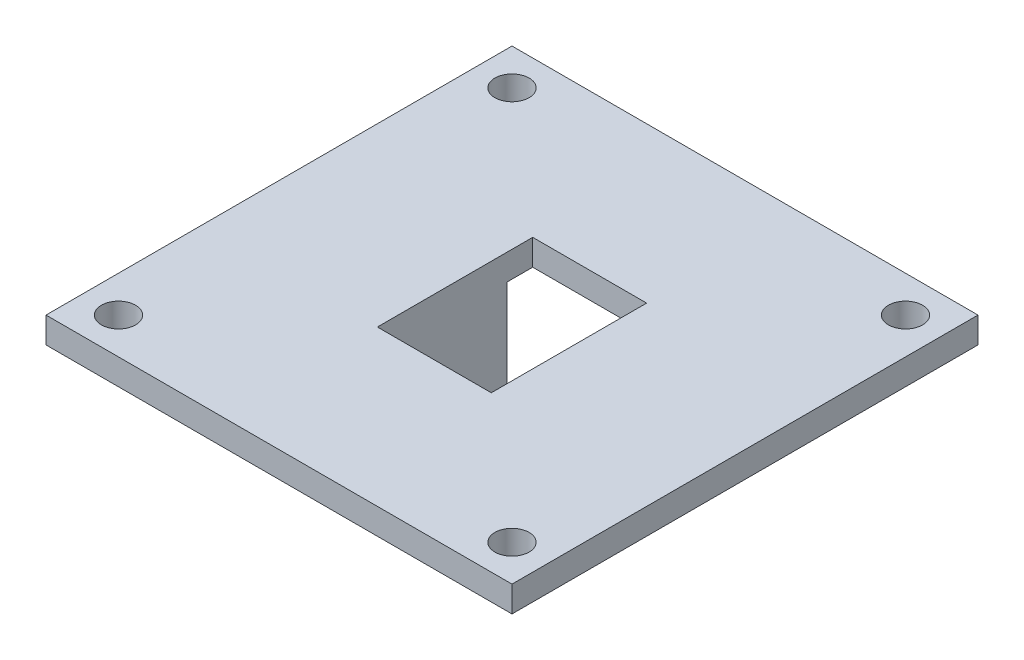
from build123d import *

# Parameters (mm, degrees)
SKETCH_1_R               = 19
EXTRUDE_1_DEPTH          = 3
CUT_EXTRUDE_1_REACH      = 29.037
SKETCH_2_R               = 1.6
SKETCH_3_W               = 4
SKETCH_3_H               = 20
EXTRUDE_2_DEPTH          = 20
SKETCH_4_W               = 90
SKETCH_4_H               = 90
EXTRUDE_3_DEPTH          = 5
CUT_EXTRUDE_2_DEPTH      = 70.526973183
CUT_EXTRUDE_2_DEPTH_BACK = 70.526973183
SKETCH_5_R               = 3.3
CUT_EXTRUDE_3_DEPTH      = 70.526973183
CUT_EXTRUDE_3_DEPTH_BACK = 5
SKETCH_6_W               = 22
SKETCH_6_H               = 30


with BuildPart() as part:
    # 草图1 → 凸台-拉伸1 (new body)
    with BuildSketch(Plane(origin=(0, 0, 0), x_dir=(1, 0, 0), z_dir=(0, 1, 0))):
        with Locations(Location((0, 0, 0), (0, 0, 270))):
            Circle(SKETCH_1_R)
    extrude(amount=EXTRUDE_1_DEPTH)

    # 草图2 → 切除-拉伸1 (cut, up to next)
    with BuildSketch(Plane(origin=(0, 3, 0), x_dir=(1, 0, 0), z_dir=(0, 1, 0)), mode=Mode.PRIVATE) as cut_extrude_1_sk1:
        with Locations(Location((-5, 0, 0), (0, 0, 270))):
            Circle(SKETCH_2_R)
    cut_extrude_1_tool1 = extrude(cut_extrude_1_sk1.sketch, amount=-CUT_EXTRUDE_1_REACH, mode=Mode.PRIVATE) & part.part
    # 草图2 → 切除-拉伸1 (cut, up to next)
    with BuildSketch(Plane(origin=(0, 3, 0), x_dir=(1, 0, 0), z_dir=(0, 1, 0)), mode=Mode.PRIVATE) as cut_extrude_1_sk2:
        with Locations(Location((0, 0, 0), (0, 0, 270))):
            Circle(SKETCH_2_R)
    cut_extrude_1_tool2 = extrude(cut_extrude_1_sk2.sketch, amount=-CUT_EXTRUDE_1_REACH, mode=Mode.PRIVATE) & part.part
    # 草图2 → 切除-拉伸1 (cut, up to next)
    with BuildSketch(Plane(origin=(0, 3, 0), x_dir=(1, 0, 0), z_dir=(0, 1, 0)), mode=Mode.PRIVATE) as cut_extrude_1_sk3:
        with Locations(Location((5, 0, 0), (0, 0, 270))):
            Circle(SKETCH_2_R)
    cut_extrude_1_tool3 = extrude(cut_extrude_1_sk3.sketch, amount=-CUT_EXTRUDE_1_REACH, mode=Mode.PRIVATE) & part.part
    # 草图2 → 切除-拉伸1 (cut, up to next)
    with BuildSketch(Plane(origin=(0, 3, 0), x_dir=(1, 0, 0), z_dir=(0, 1, 0)), mode=Mode.PRIVATE) as cut_extrude_1_sk4:
        with Locations(Location((0, -5, 0), (0, 0, 270))):
            Circle(SKETCH_2_R)
    cut_extrude_1_tool4 = extrude(cut_extrude_1_sk4.sketch, amount=-CUT_EXTRUDE_1_REACH, mode=Mode.PRIVATE) & part.part
    add(cut_extrude_1_tool1.solids().sort_by_distance((-5, 3, 0))[0], mode=Mode.SUBTRACT)
    add(cut_extrude_1_tool2.solids().sort_by_distance((0, 3, 0))[0], mode=Mode.SUBTRACT)
    add(cut_extrude_1_tool3.solids().sort_by_distance((5, 3, 0))[0], mode=Mode.SUBTRACT)
    add(cut_extrude_1_tool4.solids().sort_by_distance((0, 3, 5))[0], mode=Mode.SUBTRACT)

    # 草图3 → 凸台-拉伸2 (add)
    with BuildSketch(Plane(origin=(0, 3, 0), x_dir=(1, 0, 0), z_dir=(0, 1, 0))):
        with Locations((-13, 0)):
            Rectangle(SKETCH_3_W, SKETCH_3_H)
        with Locations((13, 0)):
            Rectangle(SKETCH_3_W, SKETCH_3_H)
    extrude(amount=EXTRUDE_2_DEPTH)

    # 草图4 → 凸台-拉伸3 (add)
    with BuildSketch(Plane(origin=(0, 23, 0), x_dir=(1, 0, 0), z_dir=(0, 1, 0))):
        Rectangle(SKETCH_4_W, SKETCH_4_H)
    extrude(amount=EXTRUDE_3_DEPTH)

    # 草图5 → 切除-拉伸2 (cut, two sides: drawn at the far end of the back side and taken through both)
    with BuildSketch(Plane(origin=(0, 28, 0), x_dir=(1, 0, 0), z_dir=(0, 1, 0)).offset(-CUT_EXTRUDE_2_DEPTH_BACK)):
        with Locations(Location((-38, 38, 0), (0, 0, 270))):
            Circle(SKETCH_5_R)
        with Locations(Location((38, 38, 0), (0, 0, 270))):
            Circle(SKETCH_5_R)
        with Locations(Location((-38, -38, 0), (0, 0, 270))):
            Circle(SKETCH_5_R)
        with Locations(Location((38, -38, 0), (0, 0, 270))):
            Circle(SKETCH_5_R)
    extrude(amount=CUT_EXTRUDE_2_DEPTH + CUT_EXTRUDE_2_DEPTH_BACK, mode=Mode.SUBTRACT)

    # 草图6 → 切除-拉伸3 (cut, two sides: drawn at the far end of the back side and taken through both)
    with BuildSketch(Plane(origin=(0, 28, 0), x_dir=(1, 0, 0), z_dir=(0, 1, 0)).offset(-CUT_EXTRUDE_3_DEPTH_BACK)):
        Rectangle(SKETCH_6_W, SKETCH_6_H)
    extrude(amount=CUT_EXTRUDE_3_DEPTH + CUT_EXTRUDE_3_DEPTH_BACK, mode=Mode.SUBTRACT)


solid = part.part
